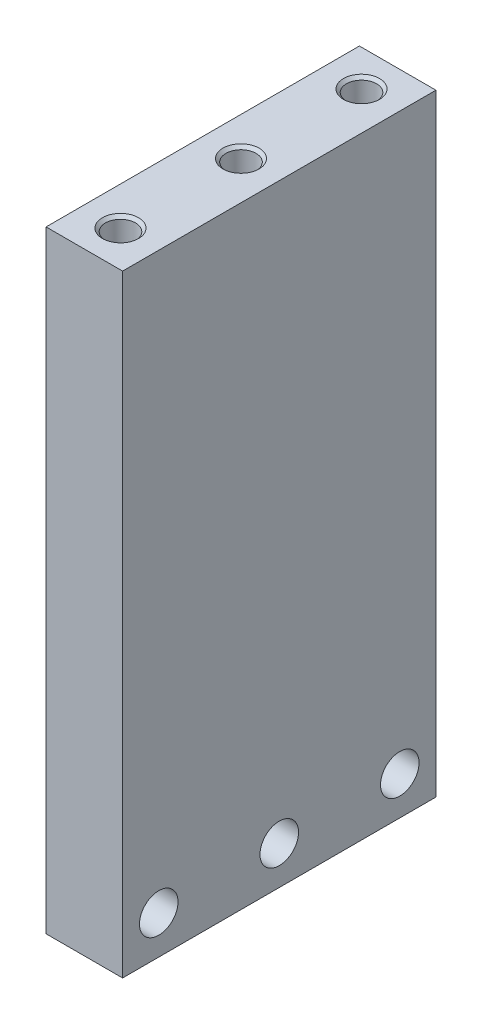
from build123d import *

# Parameters (mm, degrees)
SKETCH1_W           = 6.35
SKETCH1_H           = 50.8
BOSS_EXTRUDE1_DEPTH = 26
SKETCH4_R           = 1.6
CUT_EXTRUDE3_DEPTH  = 6.35
SKETCH14_R          = 1.25
CUT_EXTRUDE13_DEPTH = 5
CHAMFER3_SIZE       = 0.25


with BuildPart() as part:
    # Sketch1 → Boss-Extrude1 (new body)
    with BuildSketch(Plane.XY):
        with Locations((3.175, 25.4)):
            Rectangle(SKETCH1_W, SKETCH1_H)
    extrude(amount=BOSS_EXTRUDE1_DEPTH)

    # Sketch4 → Cut-Extrude3 (cut)
    with BuildSketch(Plane(origin=(6.35, 0, 0), x_dir=(0, 0, -1), z_dir=(1, 0, 0))):
        with Locations((-3, 3.175)):
            Circle(SKETCH4_R)
        with Locations((-23, 3.175)):
            Circle(SKETCH4_R)
        with Locations((-13, 3.175)):
            Circle(SKETCH4_R)
    extrude(amount=-CUT_EXTRUDE3_DEPTH, mode=Mode.SUBTRACT)

    # Sketch14 → Cut-Extrude13 (cut)
    with BuildSketch(Plane(origin=(0, 50.8, 0), x_dir=(1, 0, 0), z_dir=(0, 1, 0))):
        with Locations(Location((3.175, -23, 0), (0, 0, 270))):
            Circle(SKETCH14_R)
        with Locations(Location((3.175, -13, 0), (0, 0, 270))):
            Circle(SKETCH14_R)
        with Locations(Location((3.175, -3, 0), (0, 0, 270))):
            Circle(SKETCH14_R)
    extrude(amount=-CUT_EXTRUDE13_DEPTH, mode=Mode.SUBTRACT)

    # Chamfer3
    chamfer3_edges = [part.edges().sort_by_distance(p)[0] for p in [
        (3.175, 50.8, 21.75),
        (3.175, 50.8, 11.75),
        (3.175, 50.8, 1.75),
    ]]
    chamfer(chamfer3_edges, length=CHAMFER3_SIZE)


solid = part.part
